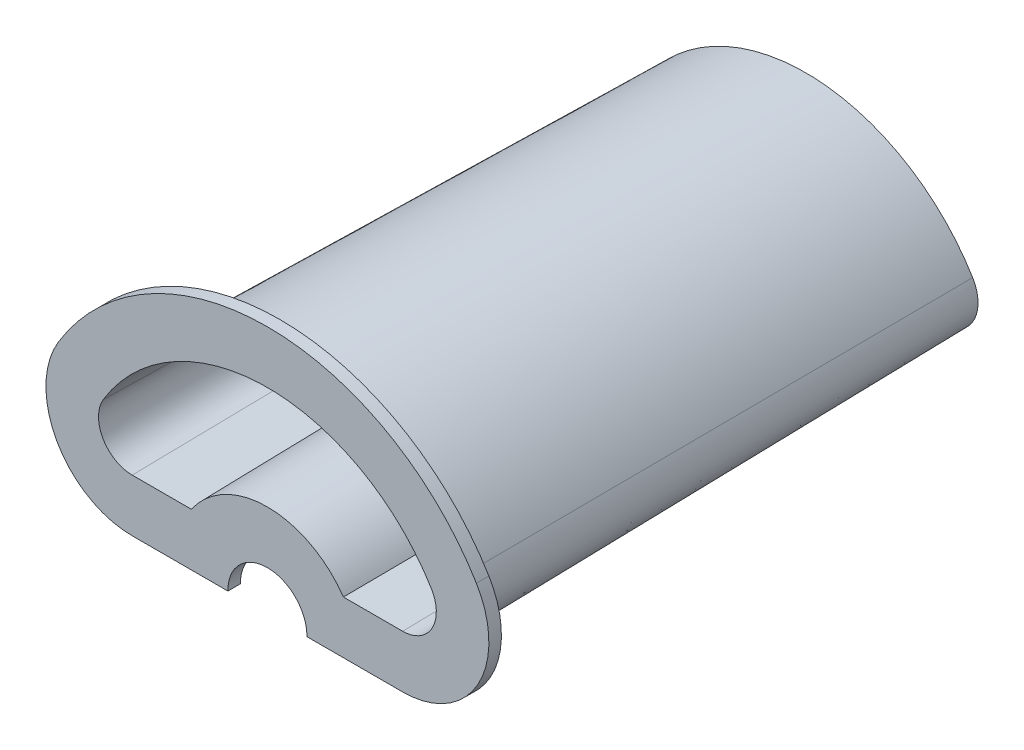
from build123d import *

# Parameters (mm, degrees)
BASE_EXTRUDE_DEPTH  = 105
BASE_EXTRUDE_DRAFT  = -1
BOSS_EXTRUDE1_DEPTH = 2.5
CUT_EXTRUDE1_DEPTH  = 105
CUT_EXTRUDE1_DRAFT  = -1


with BuildPart() as part:
    # Sketch1 → Base-Extrude (with draft: the straight prism first)
    with BuildSketch(Plane.XY):
        with BuildLine():
            ThreePointArc((27, 10.394421907), (35.038693587, 15.093935147), (34.887046373, 24.404306911))
            ThreePointArc((34.887046373, 24.404306911), (0, 44.044421907), (-34.887046373, 24.404306911))
            ThreePointArc((-34.887046373, 24.404306911), (-35.038693587, 15.093935147), (-27, 10.394421907))
            Line((-27, 10.394421907), (-13.793114224, 10.394421907))
            ThreePointArc((-13.793114224, 10.394421907), (0, 18.394421907), (13.793114224, 10.394421907))
            Line((13.793114224, 10.394421907), (27, 10.394421907))
        make_face()
    extrude(amount=-BASE_EXTRUDE_DEPTH)
    # Base-Extrude: the draft: its side faces are tilted about the plane it starts from
    base_extrude_sides = [part.faces().sort_by_distance(p)[0] for p in [
        (20.396557112, 10.394421907, -52.5),
        (35.038693587, 15.093935147, -52.5),
        (0, 44.044421907, -52.5),
        (-35.038693587, 15.093935147, -52.5),
        (-20.396557112, 10.394421907, -52.5),
        (0, 18.394421907, -52.5),
    ]]
    draft(base_extrude_sides, Plane.XY, BASE_EXTRUDE_DRAFT)

    # Sketch2 → Boss-Extrude1 (add)
    with BuildSketch(Plane.XY):
        with BuildLine():
            Line((7.889866919, 2.394421907), (27, 2.394421907))
            ThreePointArc((27, 2.394421907), (42.009918378, 11.169393783), (41.726761385, 28.553800683))
            ThreePointArc((41.726761385, 28.553800683), (0, 52.044421907), (-41.726761385, 28.553800683))
            ThreePointArc((-41.726761385, 28.553800683), (-42.009918378, 11.169393783), (-27, 2.394421907))
            Line((-27, 2.394421907), (-7.889866919, 2.394421907))
            ThreePointArc((-7.889866919, 2.394421907), (0, 10.394421907), (7.889866919, 2.394421907))
        make_face()
    extrude(amount=BOSS_EXTRUDE1_DEPTH)


with BuildPart() as cut_extrude1_tool:
    # Sketch4 → Cut-Extrude1 (with draft: the straight prism first)
    with BuildSketch(Plane.XY.offset(2.5)):
        with BuildLine():
            Line((-27, 12.894421907), (-15.173990905, 12.894421907))
            ThreePointArc((-15.173990905, 12.894421907), (0, 20.894421907), (15.173990905, 12.894421907))
            Line((15.173990905, 12.894421907), (27, 12.894421907))
            ThreePointArc((27, 12.894421907), (32.86018584, 16.320354323), (32.749635432, 23.107590108))
            ThreePointArc((32.749635432, 23.107590108), (0, 41.544421907), (-32.749635432, 23.107590108))
            ThreePointArc((-32.749635432, 23.107590108), (-32.86018584, 16.320354323), (-27, 12.894421907))
        make_face()
    extrude(amount=-CUT_EXTRUDE1_DEPTH)
    # Cut-Extrude1: the draft: its side faces are tilted about the plane it starts from
    cut_extrude1_sides = [cut_extrude1_tool.faces().sort_by_distance(p)[0] for p in [
        (-21.086995453, 12.894421907, -50),
        (0, 20.894421907, -50),
        (21.086995453, 12.894421907, -50),
        (32.86018584, 16.320354323, -50),
        (0, 41.544421907, -50),
        (-32.86018584, 16.320354323, -50),
    ]]
    draft(cut_extrude1_sides, Plane.XY.offset(2.5), CUT_EXTRUDE1_DRAFT)


with BuildPart() as part_1:
    add(part.part)

    # Cut-Extrude1: cut by cut_extrude1_tool
    add(cut_extrude1_tool.part, mode=Mode.SUBTRACT)

    # Boss-Extrude2 cone 1 section (through the dimple's axis) → Boss-Extrude2 (revolve)
    with BuildSketch(Plane(origin=(29.717139782, 16.873028946, -105), x_dir=(0, -1, 0), z_dir=(1, 0, 0))):
        Polygon((0, 0), (1.4, 0), (0, 1.4), align=None)
    revolve(axis=Axis((29.717139782, 16.873028946, -105), (0, 0, -1)))


solid = part_1.part
